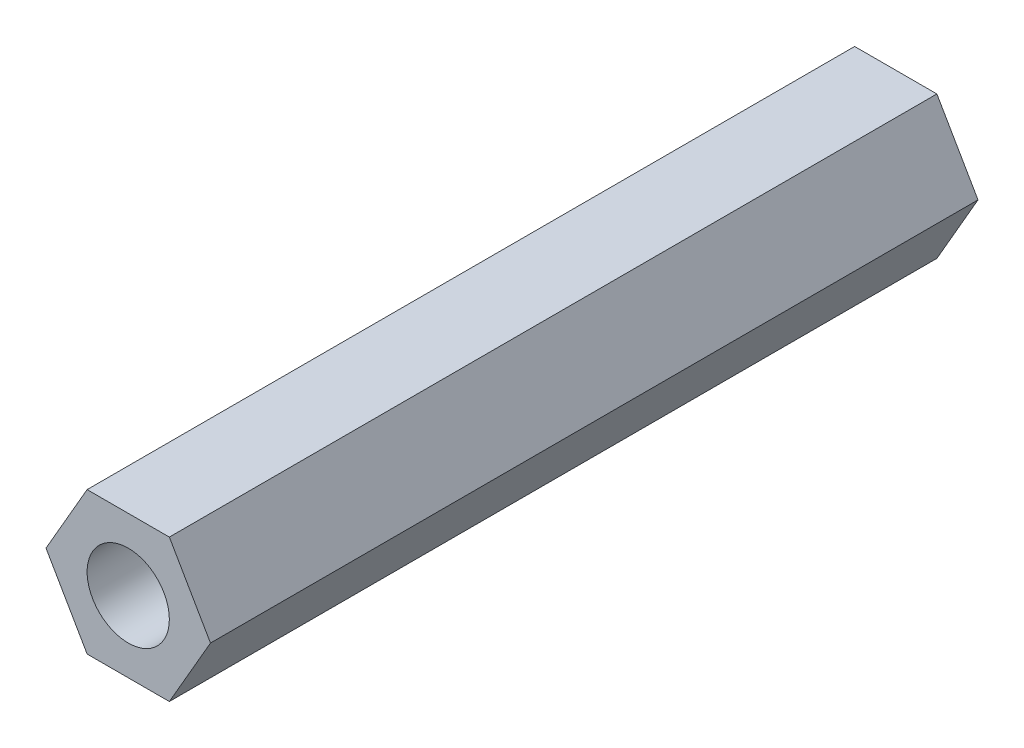
from build123d import *

# Parameters (mm, degrees)
SKETCH_1_R      = 1.5
EXTRUDE_1_DEPTH = 28


with BuildPart() as part:
    # Эскиз1 → Бобышка-Вытянуть1 (new body)
    with BuildSketch(Plane.XY):
        Polygon((3, 0), (1.5, 2.598076211), (-1.5, 2.598076211), (-3, 0), (-1.5, -2.598076211), (1.5, -2.598076211), align=None)
        Circle(SKETCH_1_R, mode=Mode.SUBTRACT)
    extrude(amount=EXTRUDE_1_DEPTH)


solid = part.part
